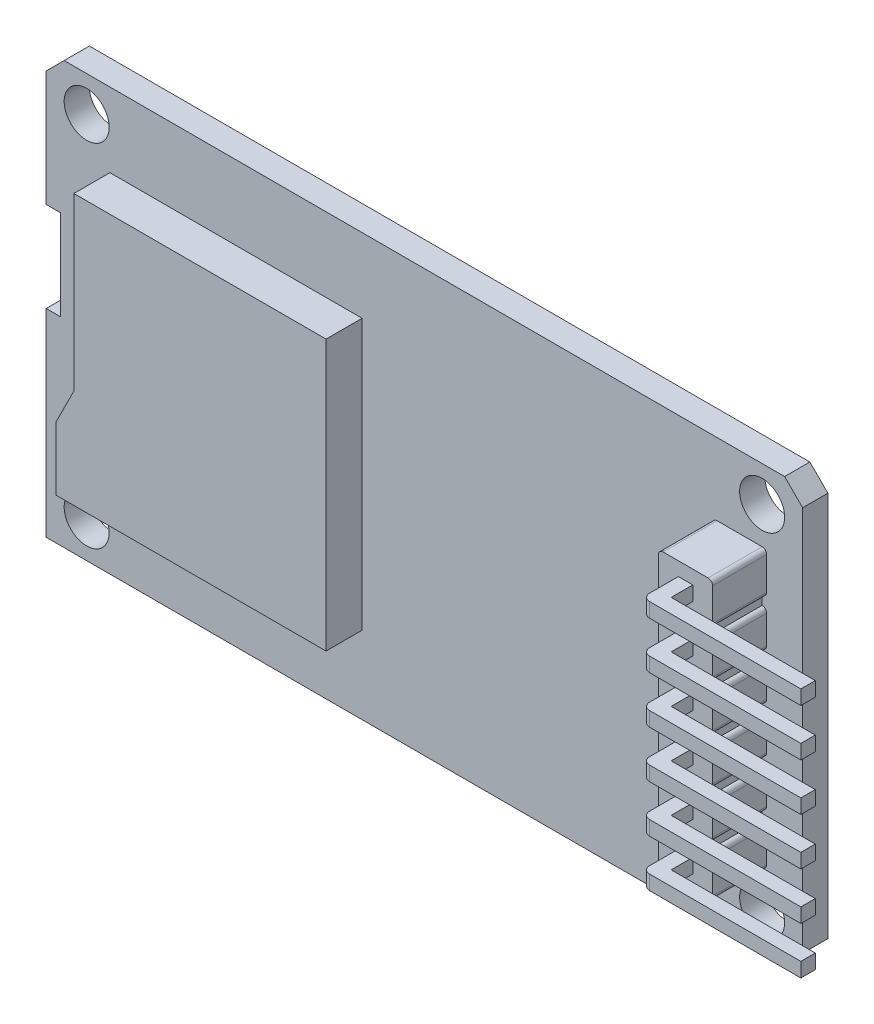
from build123d import *

# Parameters (mm, degrees)
BOSS_EXTRUDE1_DEPTH        = 1.4
F_2_5_2_5_DIAMETER_SLOT1_D = 2.5
BOSS_EXTRUDE2_DEPTH        = 2
BOSS_EXTRUDE3_DEPTH        = 3
SKETCH8_W                  = 0.8
SKETCH8_H                  = 0.8
BOSS_EXTRUDE4_DEPTH        = 2
SKETCH9_W                  = 0.8
SKETCH9_H                  = 0.8
BOSS_EXTRUDE5_DEPTH        = 8
LPATTERN1_COUNT            = 6
LPATTERN1_PITCH            = 2.62
FILLET1_R                  = 0.4


with BuildPart() as part:
    # Sketch1 → Boss-Extrude1 (new body)
    with BuildSketch(Plane.XY):
        Polygon((-17.623529412, 11.42), (-16.623529412, 12.42), (23.376470588, 12.42), (24.376470588, 11.42), (24.376470588, -10), (23.376470588, -11), (-17.623529412, -11), (-17.623529412, 0), (-16.823529412, 0), (-16.823529412, 5), (-17.623529412, 5), align=None)
    extrude(amount=BOSS_EXTRUDE1_DEPTH)

    # Ø2.5 (2.5) Diameter Slot1 (through all)
    with Locations(Plane.XY.offset(1.4)):
        with Locations((-15.373529412, -9.04), (-15.373529412, 10.46), (22.126470588, -9.04), (22.126470588, 10.46)):
            Hole(F_2_5_2_5_DIAMETER_SLOT1_D / 2)

    # Sketch6 → Boss-Extrude2 (add)
    with BuildSketch(Plane.XY.offset(1.4)):
        Polygon((-15.083529412, -6.7), (-0.083529412, -6.7), (-0.083529412, 8.3), (-14.083529412, 8.3), (-14.083529412, -1.2), (-15.083529412, -3.2), align=None)
    extrude(amount=BOSS_EXTRUDE2_DEPTH)

    # Sketch7 → Boss-Extrude3 (add)
    with BuildSketch(Plane.XY.offset(1.4)):
        with BuildLine():
            Line((22.126470588, 6.1), (22.126470588, 5.6))
            ThreePointArc((22.126470588, 5.6), (22.303247284, 5.526776695), (22.376470588, 5.35))
            Line((22.376470588, 5.35), (22.376470588, 3.78))
            ThreePointArc((22.376470588, 3.78), (22.303247284, 3.603223305), (22.126470588, 3.53))
            Line((22.126470588, 3.53), (22.126470588, 3.03))
            ThreePointArc((22.126470588, 3.03), (22.303247284, 2.956776695), (22.376470588, 2.78))
            Line((22.376470588, 2.78), (22.376470588, 1.21))
            ThreePointArc((22.376470588, 1.21), (22.303247284, 1.033223305), (22.126470588, 0.96))
            Line((22.126470588, 0.96), (22.126470588, 0.46))
            ThreePointArc((22.126470588, 0.46), (22.303247284, 0.386776695), (22.376470588, 0.21))
            Line((22.376470588, 0.21), (22.376470588, -1.36))
            ThreePointArc((22.376470588, -1.36), (22.303247284, -1.536776695), (22.126470588, -1.61))
            Line((22.126470588, -1.61), (22.126470588, -2.11))
            ThreePointArc((22.126470588, -2.11), (22.303247284, -2.183223305), (22.376470588, -2.36))
            Line((22.376470588, -2.36), (22.376470588, -3.93))
            ThreePointArc((22.376470588, -3.93), (22.303247284, -4.106776695), (22.126470588, -4.18))
            Line((22.126470588, -4.18), (22.126470588, -4.68))
            ThreePointArc((22.126470588, -4.68), (22.303247284, -4.753223305), (22.376470588, -4.93))
            Line((22.376470588, -4.93), (22.376470588, -6.75))
            ThreePointArc((22.376470588, -6.75), (22.303247284, -6.926776695), (22.126470588, -7))
            Line((22.126470588, -7), (19.626470588, -7))
            ThreePointArc((19.626470588, -7), (19.449693893, -6.926776695), (19.376470588, -6.75))
            Line((19.376470588, -6.75), (19.376470588, -4.93))
            ThreePointArc((19.376470588, -4.93), (19.449693893, -4.753223305), (19.626470588, -4.68))
            Line((19.626470588, -4.68), (19.626470588, -4.18))
            ThreePointArc((19.626470588, -4.18), (19.449693893, -4.106776695), (19.376470588, -3.93))
            Line((19.376470588, -3.93), (19.376470588, -2.36))
            ThreePointArc((19.376470588, -2.36), (19.449693893, -2.183223305), (19.626470588, -2.11))
            Line((19.626470588, -2.11), (19.626470588, -1.61))
            ThreePointArc((19.626470588, -1.61), (19.449693893, -1.536776695), (19.376470588, -1.36))
            Line((19.376470588, -1.36), (19.376470588, 0.21))
            ThreePointArc((19.376470588, 0.21), (19.449693893, 0.386776695), (19.626470588, 0.46))
            Line((19.626470588, 0.46), (19.626470588, 0.96))
            ThreePointArc((19.626470588, 0.96), (19.449693893, 1.033223305), (19.376470588, 1.21))
            Line((19.376470588, 1.21), (19.376470588, 2.78))
            ThreePointArc((19.376470588, 2.78), (19.449693893, 2.956776695), (19.626470588, 3.03))
            Line((19.626470588, 3.03), (19.626470588, 3.53))
            ThreePointArc((19.626470588, 3.53), (19.449693893, 3.603223305), (19.376470588, 3.78))
            Line((19.376470588, 3.78), (19.376470588, 5.35))
            ThreePointArc((19.376470588, 5.35), (19.449693893, 5.526776695), (19.626470588, 5.6))
            Line((19.626470588, 5.6), (19.626470588, 6.1))
            ThreePointArc((19.626470588, 6.1), (19.449693893, 6.173223305), (19.376470588, 6.35))
            Line((19.376470588, 6.35), (19.376470588, 8.17))
            ThreePointArc((19.376470588, 8.17), (19.449693893, 8.346776695), (19.626470588, 8.42))
            Line((19.626470588, 8.42), (22.126470588, 8.42))
            ThreePointArc((22.126470588, 8.42), (22.303247284, 8.346776695), (22.376470588, 8.17))
            Line((22.376470588, 8.17), (22.376470588, 6.35))
            ThreePointArc((22.376470588, 6.35), (22.303247284, 6.173223305), (22.126470588, 6.1))
        make_face()
    extrude(amount=BOSS_EXTRUDE3_DEPTH)

    # Sketch8 → Boss-Extrude4 (add)
    with BuildSketch(Plane.XY.offset(4.4)):
        with Locations((20.876470588, -5.84)):
            Rectangle(SKETCH8_W, SKETCH8_H)
        with Locations((20.876470588, -3.22)):
            Rectangle(SKETCH8_W, SKETCH8_H)
        with Locations((20.876470588, -0.6)):
            Rectangle(SKETCH8_W, SKETCH8_H)
        with Locations((20.876470588, 2.02)):
            Rectangle(SKETCH8_W, SKETCH8_H)
        with Locations((20.876470588, 4.64)):
            Rectangle(SKETCH8_W, SKETCH8_H)
        with Locations((20.876470588, 7.26)):
            Rectangle(SKETCH8_W, SKETCH8_H)
    extrude(amount=BOSS_EXTRUDE4_DEPTH)

    # Sketch9 → Boss-Extrude5 (add)
    with BuildSketch(Plane(origin=(21.276470588, 0, 0), x_dir=(0, 0, -1), z_dir=(1, 0, 0))):
        with Locations((-6, 7.26)):
            Rectangle(SKETCH9_W, SKETCH9_H)
    boss_extrude5 = extrude(amount=BOSS_EXTRUDE5_DEPTH)

    # LPattern1: Boss-Extrude5 ×6
    with Locations(*[(0, -i * LPATTERN1_PITCH, 0) for i in range(1, LPATTERN1_COUNT)]):
        add(boss_extrude5)

    # Fillet1
    fillet1_edges = [part.edges().sort_by_distance(p)[0] for p in [
        (20.476470588, -5.84, 6.4),
        (20.476470588, -3.22, 6.4),
        (20.476470588, -0.6, 6.4),
        (20.476470588, 2.02, 6.4),
        (20.476470588, 4.64, 6.4),
        (20.476470588, 7.26, 6.4),
    ]]
    fillet(fillet1_edges, radius=FILLET1_R)


solid = part.part
